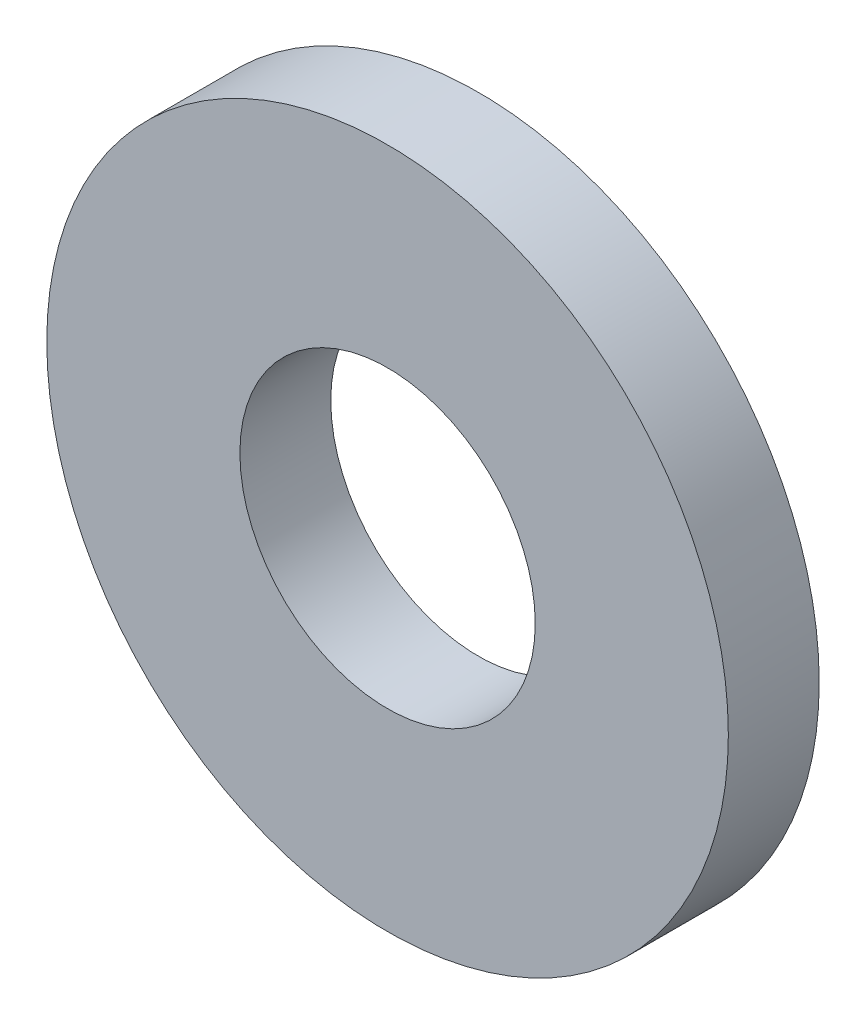
from build123d import *

# Parameters (mm, degrees)
SKETCH_1_R      = 7.5
SKETCH_1_R_2    = 3.25
EXTRUDE_1_DEPTH = 2


with BuildPart() as part:
    # 草图1 → 凸台-拉伸1 (new body)
    with BuildSketch(Plane.XY):
        Circle(SKETCH_1_R)
        Circle(SKETCH_1_R_2, mode=Mode.SUBTRACT)
    extrude(amount=EXTRUDE_1_DEPTH)


solid = part.part
